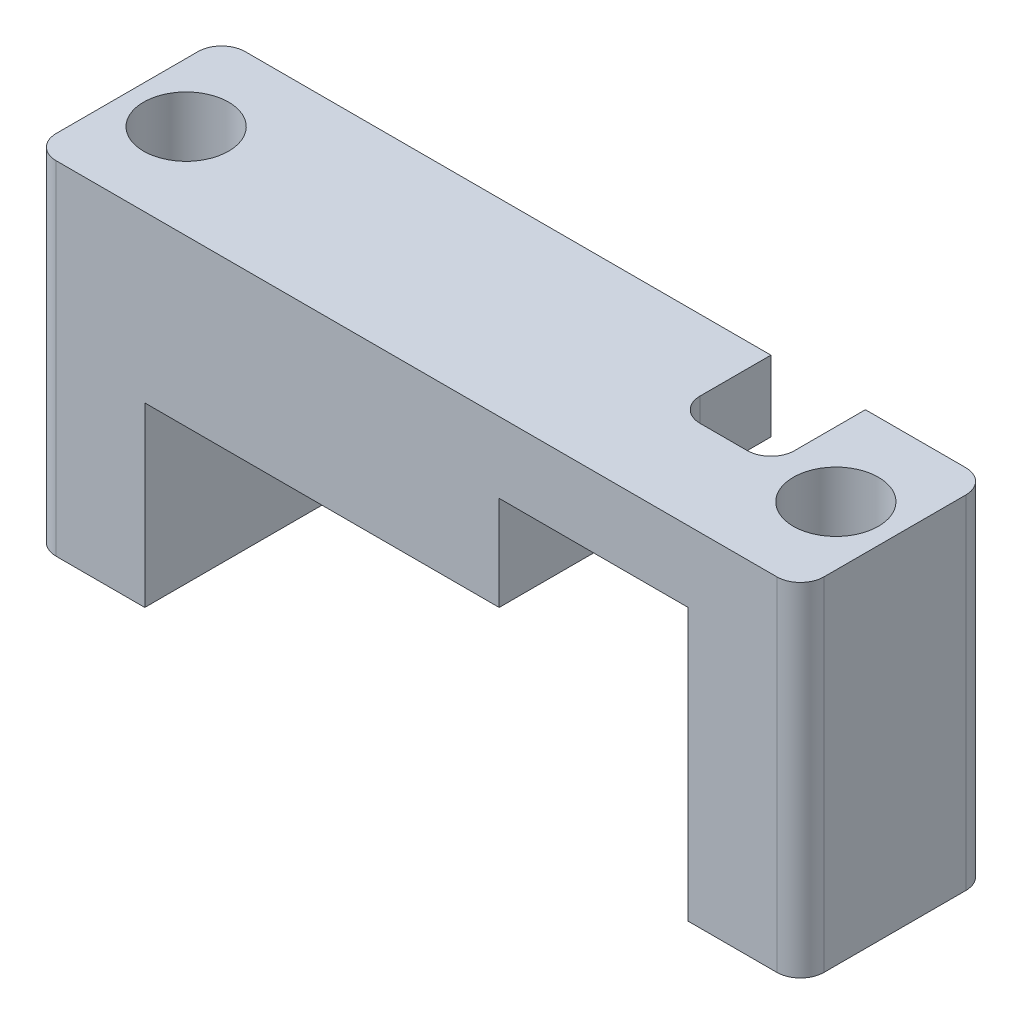
from build123d import *

# Parameters (mm, degrees)
BOSS_EXTRUDE1_DEPTH  = 8
M3_CLEARANCE_HOLE1_D = 3.6
FILLET1_R            = 1
SKETCH5_W            = 4
SKETCH5_H            = 7
CUT_EXTRUDE1_DEPTH   = 4
FILLET2_R            = 1


with BuildPart() as part:
    # Sketch1 → Boss-Extrude1 (new body)
    with BuildSketch(Plane.XY):
        Polygon((-16.25, -7.5), (-11.5, -7.5), (-11.5, 0), (3.5, 0), (3.5, 4), (11.5, 4), (11.5, -7.5), (16.25, -7.5), (16.25, 7), (-16.25, 7), align=None)
    extrude(amount=BOSS_EXTRUDE1_DEPTH)

    # M3 Clearance Hole1 (through all)
    with Locations(Plane(origin=(0, 7, 0), x_dir=(1, 0, 0), z_dir=(0, 1, 0))):
        with Locations((13.75, -4), (-13.75, -4)):
            Hole(M3_CLEARANCE_HOLE1_D / 2)

    # Fillet1
    fillet1_edges = [part.edges().sort_by_distance(p)[0] for p in [
        (-16.25, -0.25, 8),
        (-16.25, -0.25, 0),
        (16.25, -0.25, 0),
        (16.25, -0.25, 8),
    ]]
    fillet(fillet1_edges, radius=FILLET1_R)

    # Sketch5 → Cut-Extrude1 (cut)
    with BuildSketch(Plane(origin=(0, 0, 0), x_dir=(-1, 0, 0), z_dir=(0, 0, -1))):
        with Locations((-9, 3.5)):
            Rectangle(SKETCH5_W, SKETCH5_H)
    extrude(amount=-CUT_EXTRUDE1_DEPTH, mode=Mode.SUBTRACT)

    # Fillet2
    fillet2_edges = [part.edges().sort_by_distance(p)[0] for p in [
        (11, 5.5, 4),
        (7, 5.5, 4),
    ]]
    fillet(fillet2_edges, radius=FILLET2_R)


solid = part.part
